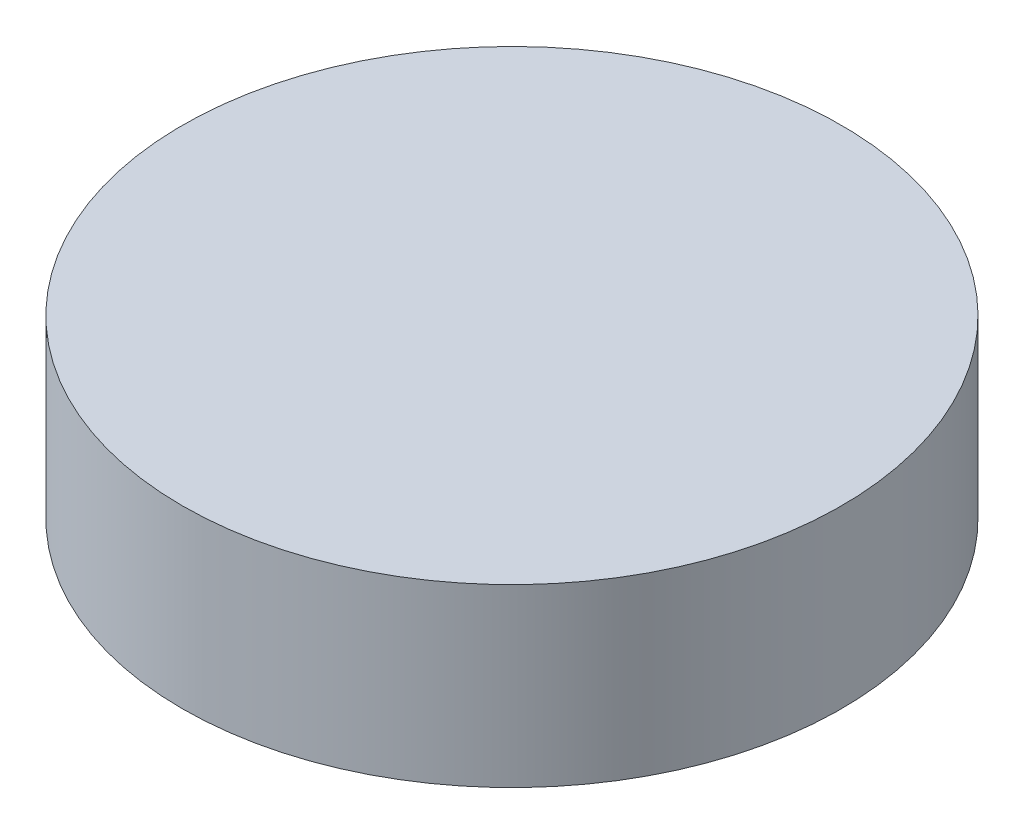
from build123d import *

# Parameters (mm, degrees)
SKETCH1_R           = 3
BOSS_EXTRUDE1_DEPTH = 1.6


with BuildPart() as part:
    # Sketch1 → Boss-Extrude1 (new body)
    with BuildSketch(Plane(origin=(0, 0, 0), x_dir=(1, 0, 0), z_dir=(0, 1, 0))):
        with Locations(Location((0, 0, 0), (0, 0, 270))):
            Circle(SKETCH1_R)
    extrude(amount=BOSS_EXTRUDE1_DEPTH)


solid = part.part
